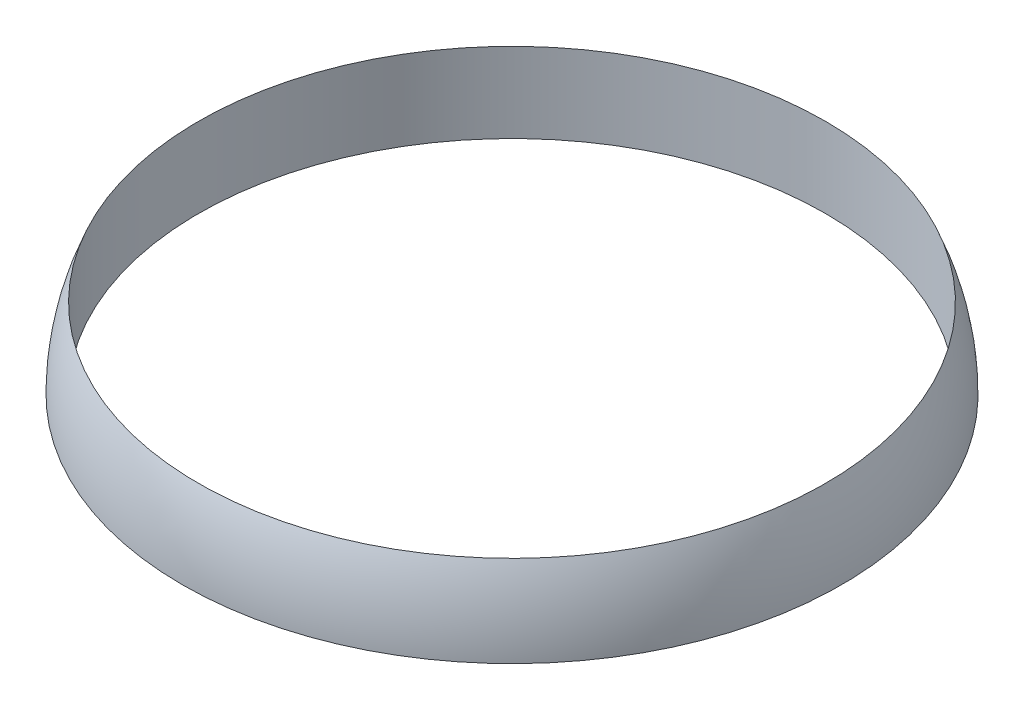
from build123d import *


with BuildPart() as part:
    # Sketch1 → Revolve1 (revolve)
    with BuildSketch(Plane(origin=(0, 0, 0), x_dir=(0, 0, -1), z_dir=(1, 0, 0))):
        with BuildLine():
            Line((78.5, 0), (78.5, 20))
            ThreePointArc((78.5, 20), (81.490195136, 10.198039027), (82.5, 0))
            Line((82.5, 0), (78.5, 0))
        make_face()
    revolve(axis=Axis((0, 0, 0), (0, 1, 0)))


solid = part.part
